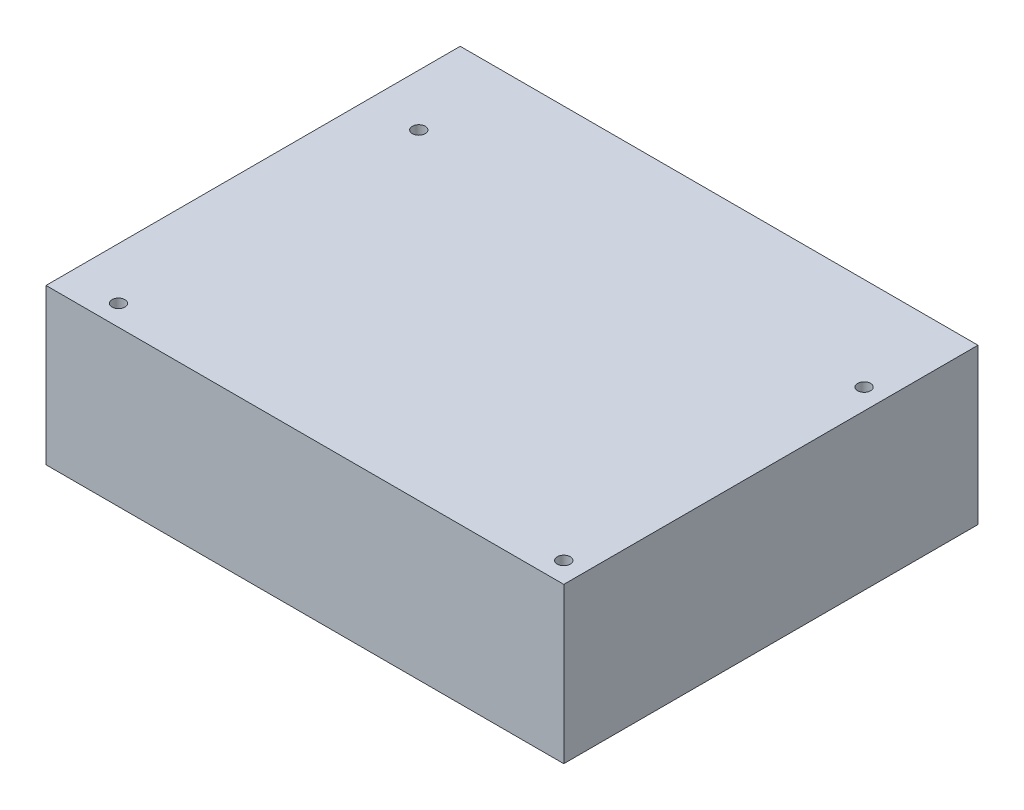
from build123d import *

# Parameters (mm, degrees)
SKETCH_1_W          = 100
SKETCH_1_H          = 80
EXTRUDE_1_DEPTH     = 30
SKETCH_2_R          = 5
CUT_EXTRUDE_1_DEPTH = 5
SKETCH_3_W          = 15
SKETCH_3_H          = 6
CUT_EXTRUDE_2_DEPTH = 5
SKETCH_5_R          = 1.25
CUT_EXTRUDE_3_DEPTH = 51


with BuildPart() as part:
    # 草图1 → 凸台-拉伸1 (new body)
    with BuildSketch(Plane(origin=(0, 0, 0), x_dir=(1, 0, 0), z_dir=(0, 1, 0))):
        Rectangle(SKETCH_1_W, SKETCH_1_H)
    extrude(amount=EXTRUDE_1_DEPTH)

    # 草图2 → 切除-拉伸1 (cut)
    with BuildSketch(Plane(origin=(0, 0, -40), x_dir=(-1, 0, 0), z_dir=(0, 0, -1))):
        with Locations((-41, 9)):
            Circle(SKETCH_2_R)
    extrude(amount=-CUT_EXTRUDE_1_DEPTH, mode=Mode.SUBTRACT)

    # 草图3 → 切除-拉伸2 (cut)
    with BuildSketch(Plane(origin=(0, 0, -40), x_dir=(-1, 0, 0), z_dir=(0, 0, -1))):
        with Locations((-12.5, 18)):
            Rectangle(SKETCH_3_W, SKETCH_3_H)
        with Locations((12.5, 18)):
            Rectangle(SKETCH_3_W, SKETCH_3_H)
        with Locations((-12.5, 6)):
            Rectangle(SKETCH_3_W, SKETCH_3_H)
        with Locations((12.5, 6)):
            Rectangle(SKETCH_3_W, SKETCH_3_H)
    extrude(amount=-CUT_EXTRUDE_2_DEPTH, mode=Mode.SUBTRACT)

    # 草图5 → 切除-拉伸3 (cut)
    with BuildSketch(Plane.XZ):
        with Locations(Location((46, 36, 0), (0, 0, 270))):
            Circle(SKETCH_5_R)
        with Locations(Location((-40, 36, 0), (0, 0, 270))):
            Circle(SKETCH_5_R)
        with Locations(Location((-40, -22, 0), (0, 0, 270))):
            Circle(SKETCH_5_R)
        with Locations(Location((46, -22, 0), (0, 0, 270))):
            Circle(SKETCH_5_R)
    extrude(amount=-CUT_EXTRUDE_3_DEPTH, mode=Mode.SUBTRACT)


solid = part.part
